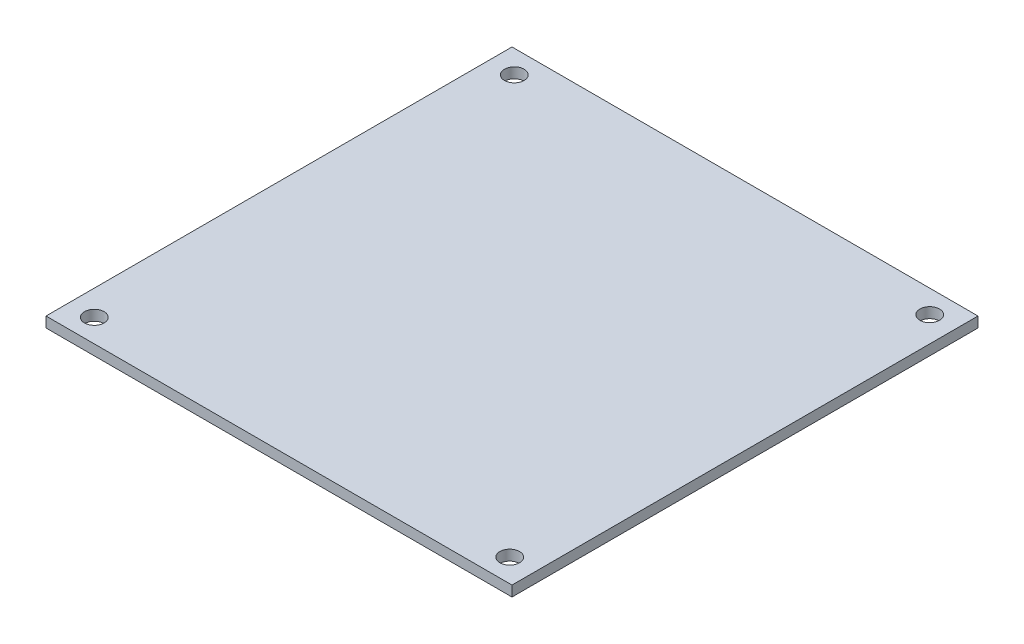
from build123d import *

# Parameters (mm, degrees)
SKETCH1_W           = 71.12
SKETCH1_H           = 71.12
SKETCH1_R           = 1.5
BOSS_EXTRUDE1_DEPTH = 1.5875


with BuildPart() as part:
    # Sketch1 → Boss-Extrude1 (new body)
    with BuildSketch(Plane(origin=(0, 0, 0), x_dir=(1, 0, 0), z_dir=(0, 1, 0))):
        Rectangle(SKETCH1_W, SKETCH1_H)
        with Locations(Location((-31.7, 32.05, 0), (0, 0, 270))):
            Circle(SKETCH1_R, mode=Mode.SUBTRACT)
        with Locations(Location((31.7, 32.05, 0), (0, 0, 90))):
            Circle(SKETCH1_R, mode=Mode.SUBTRACT)
        with Locations(Location((31.7, -32.05, 0), (0, 0, 270))):
            Circle(SKETCH1_R, mode=Mode.SUBTRACT)
        with Locations(Location((-31.7, -32.05, 0), (0, 0, 90))):
            Circle(SKETCH1_R, mode=Mode.SUBTRACT)
    extrude(amount=BOSS_EXTRUDE1_DEPTH)


solid = part.part
